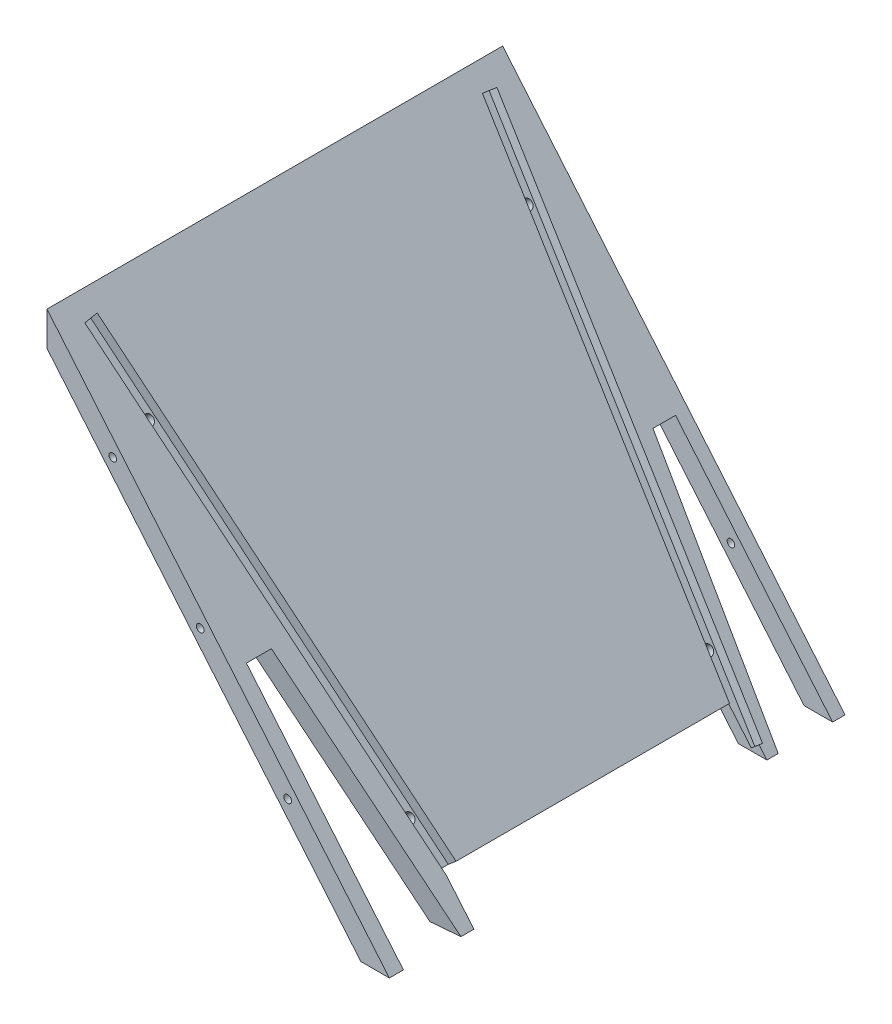
from build123d import *

# Parameters (mm, degrees)
BOSS_EXTRUDE1_DEPTH     = 170.18
CUT_EXTRUDE_THIN2_DEPTH = 3.81
CUT_EXTRUDE1_DEPTH      = 25.4
SKETCH4_R               = 1.4224
CUT_EXTRUDE2_DEPTH      = 10.16
SKETCH5_W               = 109.403315499
SKETCH5_H               = 17.948067256
CUT_EXTRUDE3_DEPTH      = 12.7
SKETCH6_R               = 1.905
CUT_EXTRUDE4_DEPTH      = 12.7


with BuildPart() as part:
    # Sketch1 → Boss-Extrude1 (new body)
    with BuildSketch(Plane.XY):
        Polygon((0, 139.7), (117.222218475, 0), (127.878783791, 0), (0, 152.4), align=None)
    extrude(amount=BOSS_EXTRUDE1_DEPTH)

    # Sketch2 → Cut-Extrude-Thin2 (cut)
    with BuildSketch(Plane(origin=(75.04235078, 62.968008862, 0), x_dir=(0, 0, -1), z_dir=(0.7660444431189745, 0.6427876096865436, 0))):
        Polygon((-137.16, -77.261258255), (-161.29, 108.554672373), (-156.252299153, 109.208866666), (-132.122299153, -76.607063962), align=None)
        Polygon((-33.02, -77.261258255), (-12.813831453, 108.554672373), (-7.763603235, 108.005495764), (-27.969771782, -77.810434864), align=None)
    extrude(amount=-CUT_EXTRUDE_THIN2_DEPTH, mode=Mode.SUBTRACT)

    # Sketch3 → Cut-Extrude1 (cut)
    with BuildSketch(Plane(origin=(75.04235078, 62.968008862, 0), x_dir=(0, 0, -1), z_dir=(0.7660444431189745, 0.6427876096865436, 0))):
        Polygon((-164.926611636, 9.038106978), (-164.926611636, -99.720446986), (-141.126263261, -99.720446986), (-155.587234425, 9.038106978), align=None)
        Polygon((-13.086414412, 9.038106978), (-27.246115343, -99.720446986), (-4.650847899, -99.720446986), (-4.650847899, 9.038106978), align=None)
    extrude(amount=-CUT_EXTRUDE1_DEPTH, mode=Mode.SUBTRACT)

    # Sketch4 → Cut-Extrude2 (cut)
    with BuildSketch(Plane.XY.offset(170.18)):
        with Locations((24.589669417, 116.745173131)):
            Circle(SKETCH4_R)
        with Locations((57.243279989, 77.830115421)):
            Circle(SKETCH4_R)
        with Locations((89.896890561, 38.91505771)):
            Circle(SKETCH4_R)
    cut_extrude2 = extrude(amount=-CUT_EXTRUDE2_DEPTH, mode=Mode.SUBTRACT)

    # Mirror1: Cut-Extrude2 across plane
    add(cut_extrude2.mirror(Plane.XY.offset(85.09)), mode=Mode.SUBTRACT)

    # Sketch5 → Cut-Extrude3 (cut)
    with BuildSketch(Plane(origin=(75.04235078, 62.968008862, 0), x_dir=(0, 0, -1), z_dir=(0.7660444431189746, 0.6427876096865437, 0))):
        with Locations((-83.900833528, -73.224864135)):
            Rectangle(SKETCH5_W, SKETCH5_H)
    extrude(amount=-CUT_EXTRUDE3_DEPTH, mode=Mode.SUBTRACT)

    # Sketch6 → Cut-Extrude4 (cut)
    with BuildSketch(Plane(origin=(72.123721451, 60.518988069, 0), x_dir=(0, 0, -1), z_dir=(0.7660444431189746, 0.6427876096865437, 0))):
        with Locations(Location((-154.682435242, 77.396139224, 0), (0, 0, 90))):
            Circle(SKETCH6_R)
        with Locations(Location((-138.327577907, -48.546381958, 0), (0, 0, 90))):
            Circle(SKETCH6_R)
        with Locations(Location((-13.719119266, 76.715945514, 0), (0, 0, 90))):
            Circle(SKETCH6_R)
        with Locations(Location((-27.440726954, -49.540608702, 0), (0, 0, 90))):
            Circle(SKETCH6_R)
    extrude(amount=-CUT_EXTRUDE4_DEPTH, mode=Mode.SUBTRACT)


solid = part.part
